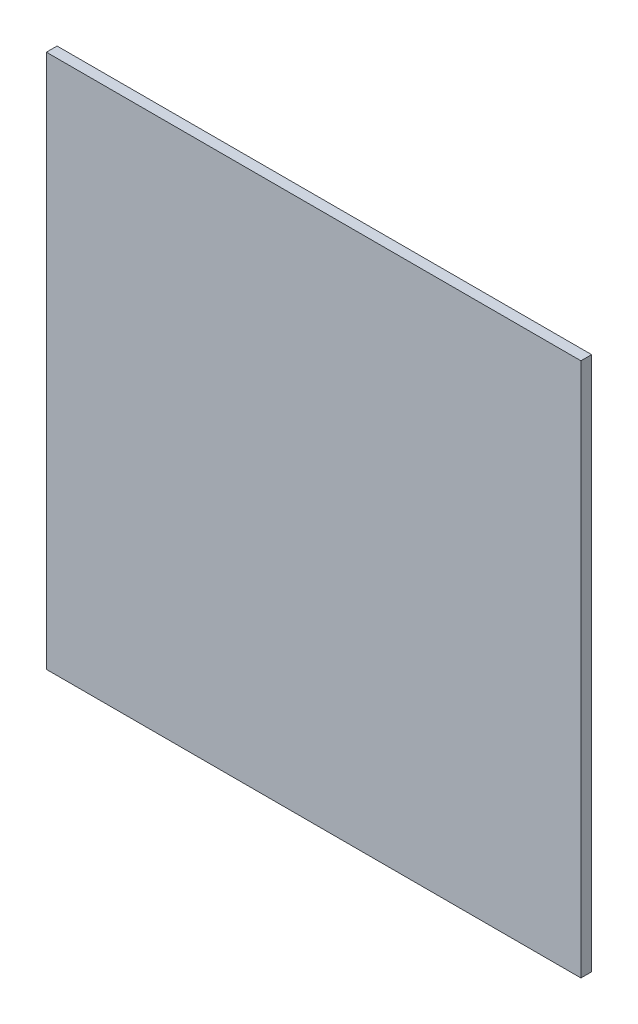
from build123d import *

# Parameters (mm, degrees)
SKETCH1_W           = 500
SKETCH1_H           = 500
BOSS_EXTRUDE1_DEPTH = 10


with BuildPart() as part:
    # Sketch1 → Boss-Extrude1 (new body)
    with BuildSketch(Plane.XY):
        Rectangle(SKETCH1_W, SKETCH1_H)
    extrude(amount=BOSS_EXTRUDE1_DEPTH)


solid = part.part
